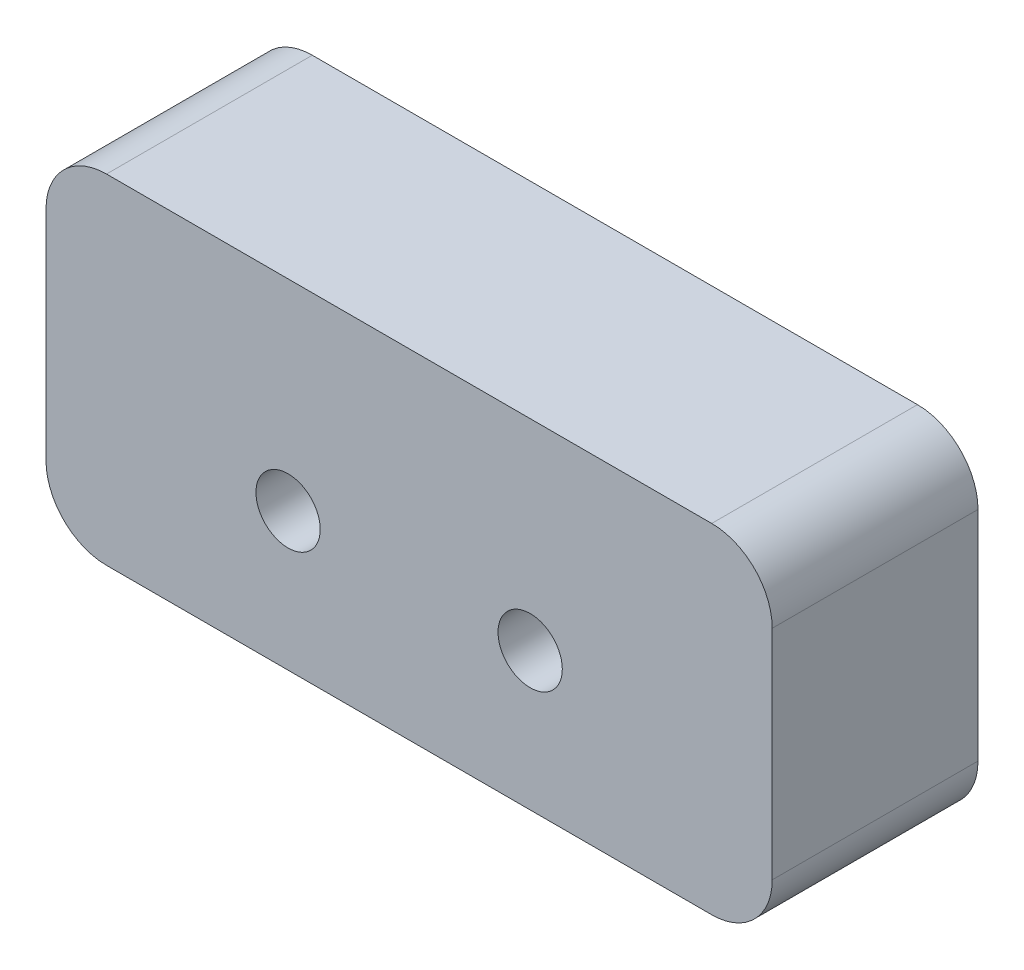
from build123d import *

# Parameters (mm, degrees)
SKETCH1_W                   = 76.2
SKETCH1_H                   = 35.56
SKETCH1_R                   = 3.3734375
BOSS_EXTRUDE1_DEPTH         = 21.59
FILLET1_R                   = 6.35
F_1_4_20_TAPPED_HOLE1_D     = 5.1054
F_1_4_20_TAPPED_HOLE1_DEPTH = 26.67
F_1_4_20_TAPPED_HOLE1_TIP   = 1.533816902


with BuildPart() as part:
    # Sketch1 → Boss-Extrude1 (new body)
    with BuildSketch(Plane.XY):
        with Locations((38.1, 17.78)):
            Rectangle(SKETCH1_W, SKETCH1_H)
        with Locations((25.4, 14.478)):
            Circle(SKETCH1_R, mode=Mode.SUBTRACT)
        with Locations((50.8, 14.478)):
            Circle(SKETCH1_R, mode=Mode.SUBTRACT)
    extrude(amount=BOSS_EXTRUDE1_DEPTH)

    # Fillet1
    fillet1_edges = [part.edges().sort_by_distance(p)[0] for p in [
        (0, 0, 10.795),
        (0, 35.56, 10.795),
        (76.2, 35.56, 10.795),
        (76.2, 0, 10.795),
    ]]
    fillet(fillet1_edges, radius=FILLET1_R)

    # 1/4-20 Tapped Hole1
    with Locations(Plane(origin=(0, 25.4, 10.795), x_dir=(0, 0, -1), z_dir=(-1, 0, 0))):
        with Locations((0, 0)):
            Hole(F_1_4_20_TAPPED_HOLE1_D / 2, depth=F_1_4_20_TAPPED_HOLE1_DEPTH)
            with Locations((0, 0, -(F_1_4_20_TAPPED_HOLE1_DEPTH + F_1_4_20_TAPPED_HOLE1_TIP / 2))):  # 118° drill point
                Cone(0, F_1_4_20_TAPPED_HOLE1_D / 2, F_1_4_20_TAPPED_HOLE1_TIP, mode=Mode.SUBTRACT)


solid = part.part
